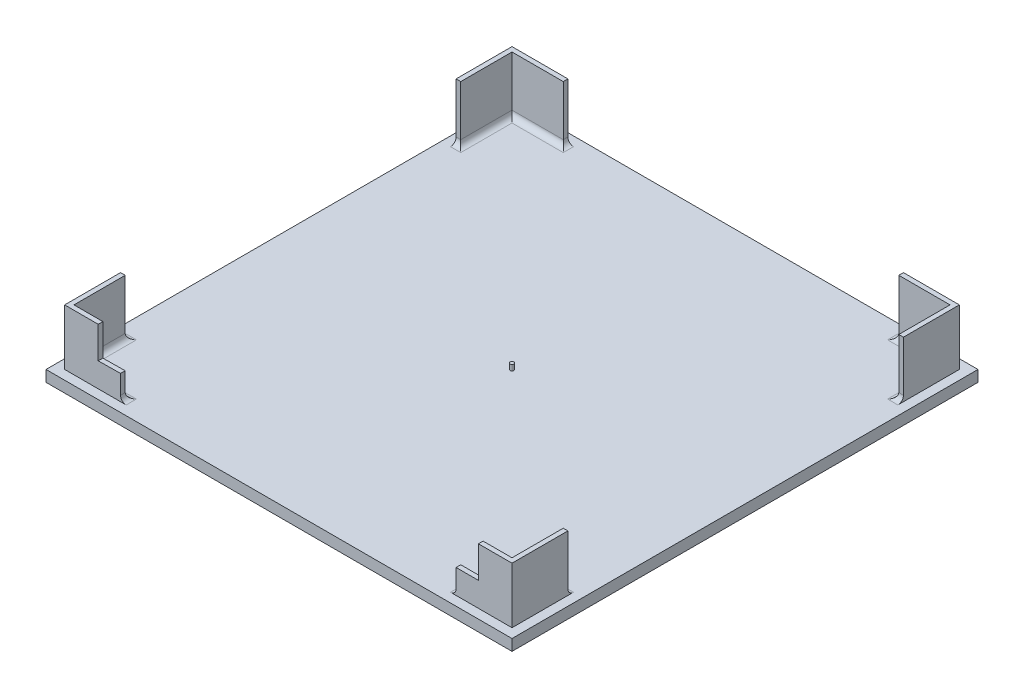
from build123d import *

# Parameters (mm, degrees)
CROQUIS1_W              = 250
CROQUIS1_H              = 250
SALIENTE_EXTRUIR1_DEPTH = 6
SALIENTE_EXTRUIR2_DEPTH = 30
REDONDEO1_R             = 3
CORTAR_EXTRUIR1_REACH   = 279.391
CROQUIS3_W              = 12
CROQUIS3_H              = 17
CROQUIS4_R              = 1
SALIENTE_EXTRUIR3_DEPTH = 3


with BuildPart() as part:
    # Croquis1 → Saliente-Extruir1 (new body)
    with BuildSketch(Plane(origin=(0, 0, 0), x_dir=(1, 0, 0), z_dir=(0, 1, 0))):
        Rectangle(CROQUIS1_W, CROQUIS1_H)
    extrude(amount=SALIENTE_EXTRUIR1_DEPTH)

    # Croquis2 → Saliente-Extruir2 (add)
    with BuildSketch(Plane(origin=(0, 6, 0), x_dir=(1, 0, 0), z_dir=(0, 1, 0))):
        Polygon((-120, 120), (-120, 90), (-117.5, 90), (-117.5, 117.5), (-90, 117.5), (-90, 120), align=None)
        Polygon((120, 120), (90, 120), (90, 117.5), (117.5, 117.5), (117.5, 90), (120, 90), align=None)
        Polygon((120, -120), (120, -90), (117.5, -90), (117.5, -117.5), (90, -117.5), (90, -120), align=None)
        Polygon((-120, -120), (-120, -90), (-117.5, -90), (-117.5, -117.5), (-90, -117.5), (-90, -120), align=None)
    extrude(amount=SALIENTE_EXTRUIR2_DEPTH)

    # Redondeo1
    redondeo1_edges = [part.edges().sort_by_distance(p)[0] for p in [
        (-118.75, 6, -90),
        (-117.5, 6, -103.75),
        (-103.75, 6, -117.5),
        (-90, 6, -118.75),
        (90, 6, -118.75),
        (103.75, 6, -117.5),
        (117.5, 6, -103.75),
        (118.75, 6, -90),
        (118.75, 6, 90),
        (117.5, 6, 103.75),
        (103.75, 6, 117.5),
        (90, 6, 118.75),
        (-90, 6, 118.75),
        (-103.75, 6, 117.5),
        (-117.5, 6, 103.75),
        (-118.75, 6, 90),
    ]]
    fillet(redondeo1_edges, radius=REDONDEO1_R)

    # Croquis3 → Cortar-Extruir1 (cut, up to next)
    with BuildSketch(Plane.XY.offset(120), mode=Mode.PRIVATE) as cortar_extruir1_sk1:
        Polygon((-102, 36), (-102, 19), (-90, 19.15390734), (-90, 36), align=None)
    cortar_extruir1_tool1 = extrude(cortar_extruir1_sk1.sketch, amount=-CORTAR_EXTRUIR1_REACH, mode=Mode.PRIVATE) & part.part
    # Croquis3 → Cortar-Extruir1 (cut, up to next)
    with BuildSketch(Plane.XY.offset(120), mode=Mode.PRIVATE) as cortar_extruir1_sk2:
        with Locations((96, 27.5)):
            Rectangle(CROQUIS3_W, CROQUIS3_H)
    cortar_extruir1_tool2 = extrude(cortar_extruir1_sk2.sketch, amount=-CORTAR_EXTRUIR1_REACH, mode=Mode.PRIVATE) & part.part
    add(cortar_extruir1_tool1.solids().sort_by_distance((-96.009095, 27.538419, 120))[0], mode=Mode.SUBTRACT)
    add(cortar_extruir1_tool2.solids().sort_by_distance((96, 27.5, 120))[0], mode=Mode.SUBTRACT)

    # Croquis4 → Saliente-Extruir3 (add)
    with BuildSketch(Plane(origin=(0, 6, 0), x_dir=(1, 0, 0), z_dir=(0, 1, 0))):
        with Locations(Location((0, 0, 0), (0, 0, 270))):
            Circle(CROQUIS4_R)
    extrude(amount=SALIENTE_EXTRUIR3_DEPTH)


solid = part.part
